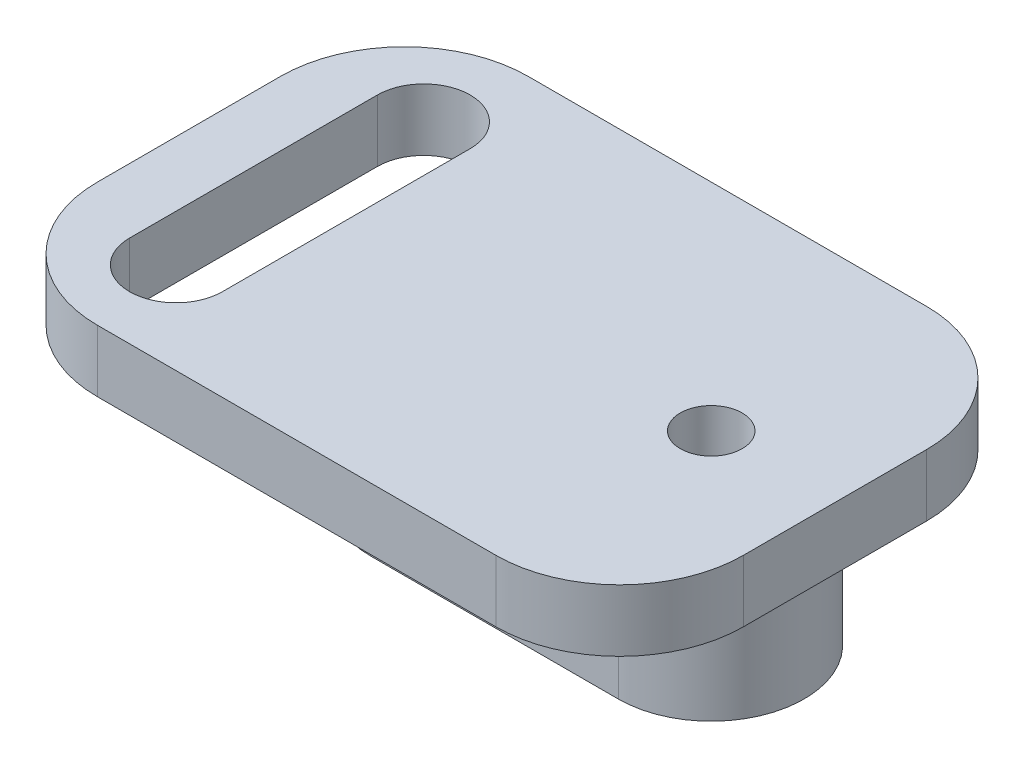
from build123d import *

# Parameters (mm, degrees)
BOSS_EXTRUDE1_DEPTH = 5
BOSS_EXTRUDE2_DEPTH = 10
SKETCH3_R           = 2.5
CUT_EXTRUDE1_DEPTH  = 16


with BuildPart() as part:
    # Sketch1 → Boss-Extrude1 (new body)
    with BuildSketch(Plane(origin=(0, 0, 0), x_dir=(1, 0, 0), z_dir=(0, 1, 0))):
        with BuildLine():
            ThreePointArc((-32.161548626, -7.391059627), (-29.232616438, -14.462127439), (-22.161548626, -17.391059627))
            Line((-22.161548626, -17.391059627), (10, -17.391059627))
            ThreePointArc((10, -17.391059627), (17.071067812, -14.462127439), (20, -7.391059627))
            Line((20, -7.391059627), (20, 7.391059627))
            ThreePointArc((20, 7.391059627), (17.071067812, 14.462127439), (10, 17.391059627))
            Line((10, 17.391059627), (-22.161548626, 17.391059627))
            ThreePointArc((-22.161548626, 17.391059627), (-29.232616438, 14.462127439), (-32.161548626, 7.391059627))
            Line((-32.161548626, 7.391059627), (-32.161548626, -7.391059627))
        make_face()
        with BuildLine():
            ThreePointArc((-26.951571496, 10), (-23.201571496, 13.75), (-19.451571496, 10))
            Line((-19.451571496, 10), (-19.451571496, -10))
            ThreePointArc((-19.451571496, -10), (-23.201571496, -13.75), (-26.951571496, -10))
            Line((-26.951571496, -10), (-26.951571496, 10))
        make_face(mode=Mode.SUBTRACT)
    extrude(amount=BOSS_EXTRUDE1_DEPTH)

    # Sketch1<3> → Boss-Extrude2 (add)
    with BuildSketch(Plane(origin=(0, 0, 0), x_dir=(1, 0, 0), z_dir=(0, 1, 0))):
        with BuildLine():
            Line((10, 7.5), (-10, 7.5))
            ThreePointArc((-10, 7.5), (-17.5, 0), (-10, -7.5))
            Line((-10, -7.5), (10, -7.5))
            ThreePointArc((10, -7.5), (17.5, 0), (10, 7.5))
        make_face()
    extrude(amount=-BOSS_EXTRUDE2_DEPTH)

    # Sketch3 → Cut-Extrude1 (cut)
    with BuildSketch(Plane.XZ.offset(10)):
        with Locations((10, 0)):
            Circle(SKETCH3_R)
    extrude(amount=-CUT_EXTRUDE1_DEPTH, mode=Mode.SUBTRACT)


solid = part.part
